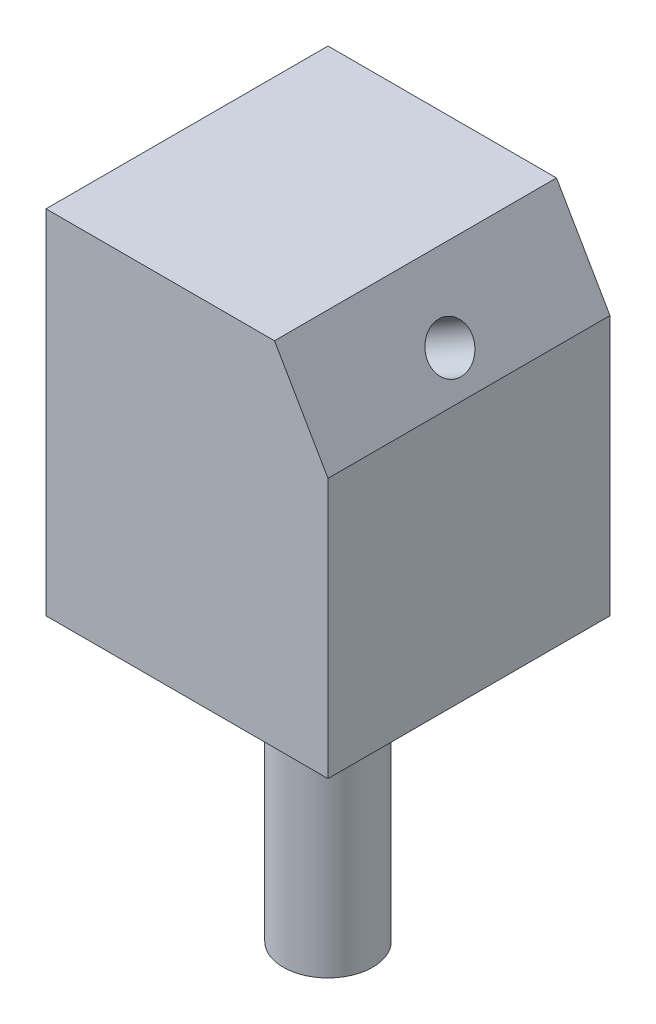
from build123d import *

# Parameters (mm, degrees)
CROQUIS1_W                 = 20
CROQUIS1_H                 = 20
SALIENTE_EXTRUIR1_DEPTH    = 30
CORTAR_EXTRUIR1_DEPTH      = 37.007356213
CORTAR_EXTRUIR1_DEPTH_BACK = 37.007356213
CROQUIS4_R                 = 1.5875
CORTAR_EXTRUIR2_DEPTH      = 30
CROQUIS7_R                 = 3.175
SALIENTE_EXTRUIR2_DEPTH    = 20
CORTAR_EXTRUIR3_DEPTH      = 39.627579186


with BuildPart() as part:
    # Croquis1 → Saliente-Extruir1 (new body)
    with BuildSketch(Plane(origin=(0, 0, 0), x_dir=(1, 0, 0), z_dir=(0, 1, 0))):
        with Locations((3.859649123, 4.298245614)):
            Rectangle(CROQUIS1_W, CROQUIS1_H)
    extrude(amount=SALIENTE_EXTRUIR1_DEPTH)

    # Croquis2 → Cortar-Extruir1 (cut, two sides: drawn at the far end of the back side and taken through both)
    with BuildSketch(Plane.XY.offset(-CORTAR_EXTRUIR1_DEPTH_BACK)):
        Polygon((13.859649123, 24.692447492), (13.859649123, 18.444349321), (11.150769621, 23.124565022), align=None)
    extrude(amount=CORTAR_EXTRUIR1_DEPTH + CORTAR_EXTRUIR1_DEPTH_BACK, mode=Mode.SUBTRACT)

    # Croquis4 → Cortar-Extruir2 (cut)
    with BuildSketch(Plane(origin=(18.37833915, 10.637267462, 0), x_dir=(0, 0, -1), z_dir=(0.8654839376667617, 0.5009366762783868, 0))):
        with Locations(Location((4.298245614, 11.724295816, 0), (0, 0, 90))):
            Circle(CROQUIS4_R)
    extrude(amount=-CORTAR_EXTRUIR2_DEPTH, mode=Mode.SUBTRACT)

    # Croquis7 → Saliente-Extruir2 (add)
    with BuildSketch(Plane.XZ):
        with Locations(Location((3.859649123, -4.298245614, 0), (0, 0, 270))):
            Circle(CROQUIS7_R)
    extrude(amount=SALIENTE_EXTRUIR2_DEPTH)

    # Croquis9 → Cortar-Extruir3 (cut, through all)
    with BuildSketch(Plane.XY.offset(5.701754386)):
        Polygon((10.065279616, 25), (-6.140350877, 25), (-6.140350877, 30), (13.859649123, 30), (13.859649123, 18.444349321), align=None)
    extrude(amount=-CORTAR_EXTRUIR3_DEPTH, mode=Mode.SUBTRACT)


solid = part.part
